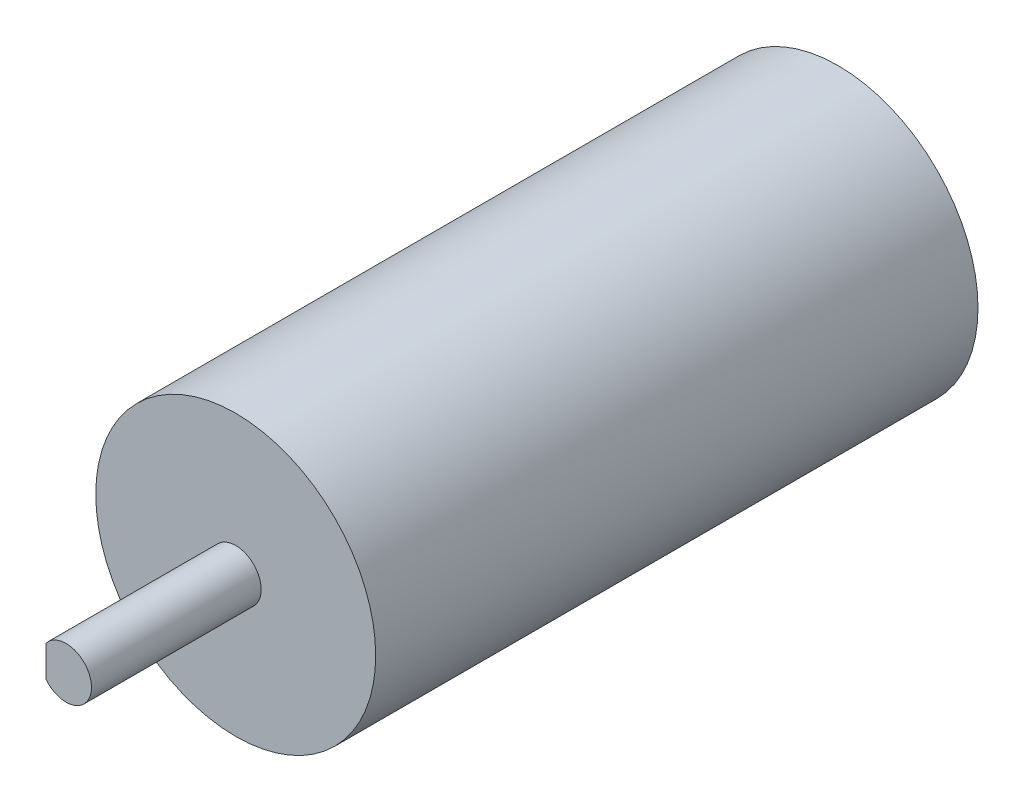
from build123d import *

# Parameters (mm, degrees)
ESQUISSE1_R             = 16.5
BOSS_EXTRU_1_DEPTH      = 71
ESQUISSE2_R             = 3
BOSS_EXTRU_2_DEPTH      = 20
ESQUISSE3_W             = 2.683906319
ESQUISSE3_H             = 8.065697874
ENL_V_MAT_EXTRU_1_DEPTH = 23


with BuildPart() as part:
    # Esquisse1 → Boss.-Extru.1 (new body)
    with BuildSketch(Plane.XY):
        with Locations((-3.936360625, 11.828431373)):
            Circle(ESQUISSE1_R)
    extrude(amount=BOSS_EXTRU_1_DEPTH)

    # Esquisse2 → Boss.-Extru.2 (add)
    with BuildSketch(Plane.XY.offset(71)):
        with Locations((-3.936360625, 11.828431373)):
            Circle(ESQUISSE2_R)
    extrude(amount=BOSS_EXTRU_2_DEPTH)

    # Esquisse3 → Enlèv. mat.-Extru.1 (cut)
    with BuildSketch(Plane.XY.offset(71)):
        with Locations((-7.643790541, 11.335031517)):
            Rectangle(ESQUISSE3_W, ESQUISSE3_H)
    extrude(amount=ENL_V_MAT_EXTRU_1_DEPTH, mode=Mode.SUBTRACT)


solid = part.part
